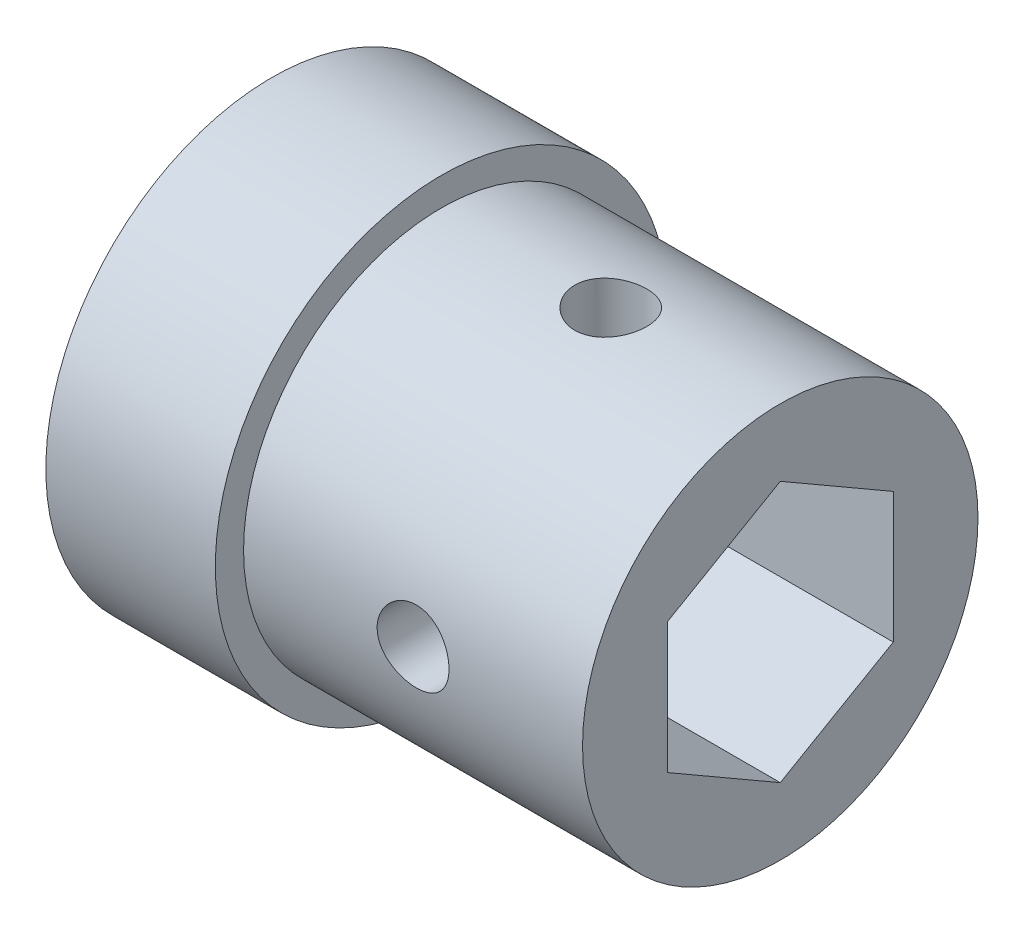
from build123d import *

# Parameters (mm, degrees)
SKETCH1_R               = 11.1125
BOSS_EXTRUDE1_DEPTH     = 19.05
SKETCH2_R               = 12.7
BOSS_EXTRUDE2_DEPTH     = 9.525
CUT_EXTRUDE1_DEPTH      = 34.750712955
CUT_EXTRUDE2_DEPTH      = 27.181720723
CUT_EXTRUDE2_DEPTH_BACK = 27.181720723
SKETCH5_R               = 2.0193
CUT_EXTRUDE3_DEPTH      = 27.181720795
CUT_EXTRUDE3_DEPTH_BACK = 27.181720795
SKETCH6_R               = 2.0193


with BuildPart() as part:
    # Sketch1 → Boss-Extrude1 (new body)
    with BuildSketch(Plane(origin=(0, 0, 0), x_dir=(0, 0, -1), z_dir=(1, 0, 0))):
        with Locations(Location((0, 0, 0), (0, 0, 180))):
            Circle(SKETCH1_R)
    extrude(amount=BOSS_EXTRUDE1_DEPTH)

    # Sketch2 → Boss-Extrude2 (add)
    with BuildSketch(Plane.ZY):
        with Locations(Location((0, 0, 0), (0, 0, 180))):
            Circle(SKETCH2_R)
    extrude(amount=BOSS_EXTRUDE2_DEPTH)

    # Sketch4 → Cut-Extrude1 (cut, through all)
    with BuildSketch(Plane.ZY.offset(9.525)):
        Polygon((0, 7.332348419), (-6.35, 3.666174209), (-6.35, -3.666174209), (0, -7.332348419), (6.35, -3.666174209), (6.35, 3.666174209), align=None)
    extrude(amount=-CUT_EXTRUDE1_DEPTH, mode=Mode.SUBTRACT)

    # Sketch5 → Cut-Extrude2 (cut, two sides: drawn at the far end of the back side and taken through both)
    with BuildSketch(Plane.XY.offset(-CUT_EXTRUDE2_DEPTH_BACK)):
        with Locations((9.525, 0)):
            Circle(SKETCH5_R)
    extrude(amount=CUT_EXTRUDE2_DEPTH + CUT_EXTRUDE2_DEPTH_BACK, mode=Mode.SUBTRACT)

    # Sketch6 → Cut-Extrude3 (cut, two sides: drawn at the far end of the back side and taken through both)
    with BuildSketch(Plane(origin=(0, 0, 0), x_dir=(1, 0, 0), z_dir=(0, 1, 0)).offset(-CUT_EXTRUDE3_DEPTH_BACK)):
        with Locations(Location((9.525, 0, 0), (0, 0, 270))):
            Circle(SKETCH6_R)
    extrude(amount=CUT_EXTRUDE3_DEPTH + CUT_EXTRUDE3_DEPTH_BACK, mode=Mode.SUBTRACT)


solid = part.part
